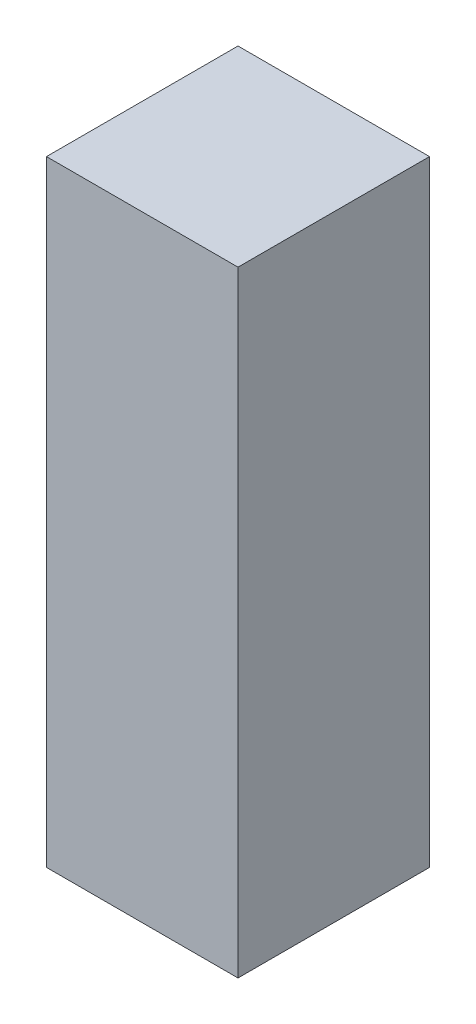
from build123d import *

# Parameters (mm, degrees)
SKETCH1_W           = 70
SKETCH1_H           = 70
BOSS_EXTRUDE1_DEPTH = 225


with BuildPart() as part:
    # Sketch1 → Boss-Extrude1 (new body)
    with BuildSketch(Plane(origin=(0, 0, 0), x_dir=(1, 0, 0), z_dir=(0, 1, 0))):
        Rectangle(SKETCH1_W, SKETCH1_H)
    extrude(amount=BOSS_EXTRUDE1_DEPTH)


solid = part.part
